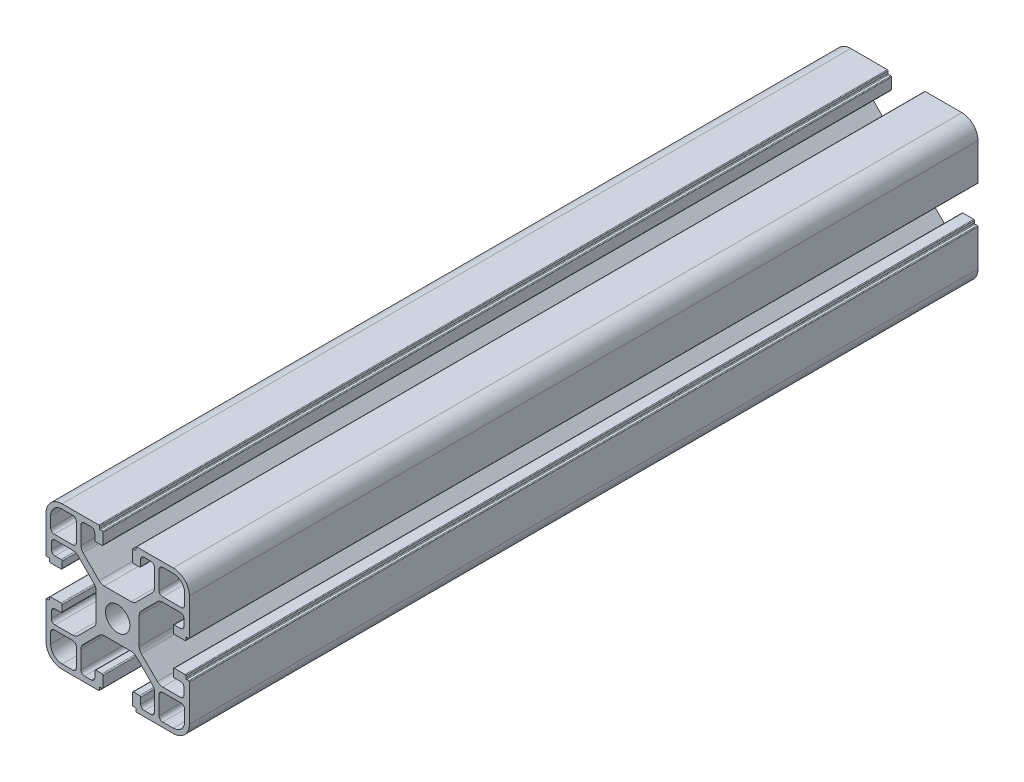
from build123d import *

# Parameters (mm, degrees)
SKETCH2_R           = 3.4
BOSS_EXTRUDE1_DEPTH = 220


with BuildPart() as part:
    # Sketch2 → Boss-Extrude1 (new body)
    with BuildSketch(Plane.XY):
        with BuildLine():
            Line((4.5, 0), (14.7, 0))
            ThreePointArc((14.7, 0), (14.841421356, 0.058578644), (14.9, 0.2))
            Line((14.9, 0.2), (14.9, 0.8))
            ThreePointArc((14.9, 0.8), (14.958578644, 0.941421356), (15.1, 1))
            Line((15.1, 1), (15.7, 1))
            ThreePointArc((15.7, 1), (15.841421356, 1.058578644), (15.9, 1.2))
            Line((15.9, 1.2), (15.9, 4.2))
            ThreePointArc((15.9, 4.2), (15.812132034, 4.412132034), (15.6, 4.5))
            Line((15.6, 4.5), (13.9, 4.5))
            ThreePointArc((13.9, 4.5), (13.687867966, 4.412132034), (13.6, 4.2))
            Line((13.6, 4.2), (13.6, 2.5))
            ThreePointArc((13.6, 2.5), (13.307106781, 1.792893219), (12.6, 1.5))
            Line((12.6, 1.5), (10.75, 1.5))
            ThreePointArc((10.75, 1.5), (10.042893219, 1.792893219), (9.75, 2.5))
            Line((9.75, 2.5), (9.75, 7.507359313))
            ThreePointArc((9.75, 7.507359313), (9.902240935, 8.272726178), (10.335786438, 8.921572875))
            Line((10.335786438, 8.921572875), (14.828427125, 13.414213562))
            ThreePointArc((14.828427125, 13.414213562), (15.477273822, 13.847759065), (16.242640687, 14))
            Line((16.242640687, 14), (23.757359313, 14))
            ThreePointArc((23.757359313, 14), (24.522726178, 13.847759065), (25.171572875, 13.414213562))
            Line((25.171572875, 13.414213562), (29.664213562, 8.921572875))
            ThreePointArc((29.664213562, 8.921572875), (30.097759065, 8.272726178), (30.25, 7.507359313))
            Line((30.25, 7.507359313), (30.25, 2.5))
            ThreePointArc((30.25, 2.5), (29.957106781, 1.792893219), (29.25, 1.5))
            Line((29.25, 1.5), (27.4, 1.5))
            ThreePointArc((27.4, 1.5), (26.692893219, 1.792893219), (26.4, 2.5))
            Line((26.4, 2.5), (26.4, 4.2))
            ThreePointArc((26.4, 4.2), (26.312132034, 4.412132034), (26.1, 4.5))
            Line((26.1, 4.5), (24.4, 4.5))
            ThreePointArc((24.4, 4.5), (24.187867966, 4.412132034), (24.1, 4.2))
            Line((24.1, 4.2), (24.1, 1.2))
            ThreePointArc((24.1, 1.2), (24.158578644, 1.058578644), (24.3, 1))
            Line((24.3, 1), (24.9, 1))
            ThreePointArc((24.9, 1), (25.041421356, 0.941421356), (25.1, 0.8))
            Line((25.1, 0.8), (25.1, 0.2))
            ThreePointArc((25.1, 0.2), (25.158578644, 0.058578644), (25.3, 0))
            Line((25.3, 0), (35.5, 0))
            ThreePointArc((35.5, 0), (38.681980515, 1.318019485), (40, 4.5))
            Line((40, 4.5), (40, 14.7))
            ThreePointArc((40, 14.7), (39.941421356, 14.841421356), (39.8, 14.9))
            Line((39.8, 14.9), (39.2, 14.9))
            ThreePointArc((39.2, 14.9), (39.058578644, 14.958578644), (39, 15.1))
            Line((39, 15.1), (39, 15.7))
            ThreePointArc((39, 15.7), (38.941421356, 15.841421356), (38.8, 15.9))
            Line((38.8, 15.9), (35.8, 15.9))
            ThreePointArc((35.8, 15.9), (35.587867966, 15.812132034), (35.5, 15.6))
            Line((35.5, 15.6), (35.5, 13.9))
            ThreePointArc((35.5, 13.9), (35.587867966, 13.687867966), (35.8, 13.6))
            Line((35.8, 13.6), (37.5, 13.6))
            ThreePointArc((37.5, 13.6), (38.207106781, 13.307106781), (38.5, 12.6))
            Line((38.5, 12.6), (38.5, 10.75))
            ThreePointArc((38.5, 10.75), (38.207106781, 10.042893219), (37.5, 9.75))
            Line((37.5, 9.75), (32.492640687, 9.75))
            ThreePointArc((32.492640687, 9.75), (31.727273822, 9.902240935), (31.078427125, 10.335786438))
            Line((31.078427125, 10.335786438), (26.585786438, 14.828427125))
            ThreePointArc((26.585786438, 14.828427125), (26.152240935, 15.477273822), (26, 16.242640687))
            Line((26, 16.242640687), (26, 23.757359313))
            ThreePointArc((26, 23.757359313), (26.152240935, 24.522726178), (26.585786438, 25.171572875))
            Line((26.585786438, 25.171572875), (31.078427125, 29.664213562))
            ThreePointArc((31.078427125, 29.664213562), (31.727273822, 30.097759065), (32.492640687, 30.25))
            Line((32.492640687, 30.25), (37.5, 30.25))
            ThreePointArc((37.5, 30.25), (38.207106781, 29.957106781), (38.5, 29.25))
            Line((38.5, 29.25), (38.5, 27.4))
            ThreePointArc((38.5, 27.4), (38.207106781, 26.692893219), (37.5, 26.4))
            Line((37.5, 26.4), (35.8, 26.4))
            ThreePointArc((35.8, 26.4), (35.587867966, 26.312132034), (35.5, 26.1))
            Line((35.5, 26.1), (35.5, 24.4))
            ThreePointArc((35.5, 24.4), (35.587867966, 24.187867966), (35.8, 24.1))
            Line((35.8, 24.1), (38.8, 24.1))
            ThreePointArc((38.8, 24.1), (38.941421356, 24.158578644), (39, 24.3))
            Line((39, 24.3), (39, 24.9))
            ThreePointArc((39, 24.9), (39.058578644, 25.041421356), (39.2, 25.1))
            Line((39.2, 25.1), (39.8, 25.1))
            ThreePointArc((39.8, 25.1), (39.941421356, 25.158578644), (40, 25.3))
            Line((40, 25.3), (40, 35.5))
            ThreePointArc((40, 35.5), (38.681980515, 38.681980515), (35.5, 40))
            Line((35.5, 40), (25.3, 40))
            ThreePointArc((25.3, 40), (25.158578644, 39.941421356), (25.1, 39.8))
            Line((25.1, 39.8), (25.1, 39.2))
            ThreePointArc((25.1, 39.2), (25.041421356, 39.058578644), (24.9, 39))
            Line((24.9, 39), (24.3, 39))
            ThreePointArc((24.3, 39), (24.158578644, 38.941421356), (24.1, 38.8))
            Line((24.1, 38.8), (24.1, 35.8))
            ThreePointArc((24.1, 35.8), (24.187867966, 35.587867966), (24.4, 35.5))
            Line((24.4, 35.5), (26.1, 35.5))
            ThreePointArc((26.1, 35.5), (26.312132034, 35.587867966), (26.4, 35.8))
            Line((26.4, 35.8), (26.4, 37.5))
            ThreePointArc((26.4, 37.5), (26.692893219, 38.207106781), (27.4, 38.5))
            Line((27.4, 38.5), (29.25, 38.5))
            ThreePointArc((29.25, 38.5), (29.957106781, 38.207106781), (30.25, 37.5))
            Line((30.25, 37.5), (30.25, 32.492640687))
            ThreePointArc((30.25, 32.492640687), (30.097759065, 31.727273822), (29.664213562, 31.078427125))
            Line((29.664213562, 31.078427125), (25.171572875, 26.585786438))
            ThreePointArc((25.171572875, 26.585786438), (24.522726178, 26.152240935), (23.757359313, 26))
            Line((23.757359313, 26), (16.242640687, 26))
            ThreePointArc((16.242640687, 26), (15.477273822, 26.152240935), (14.828427125, 26.585786438))
            Line((14.828427125, 26.585786438), (10.335786438, 31.078427125))
            ThreePointArc((10.335786438, 31.078427125), (9.902240935, 31.727273822), (9.75, 32.492640687))
            Line((9.75, 32.492640687), (9.75, 37.5))
            ThreePointArc((9.75, 37.5), (10.042893219, 38.207106781), (10.75, 38.5))
            Line((10.75, 38.5), (12.6, 38.5))
            ThreePointArc((12.6, 38.5), (13.307106781, 38.207106781), (13.6, 37.5))
            Line((13.6, 37.5), (13.6, 35.8))
            ThreePointArc((13.6, 35.8), (13.687867966, 35.587867966), (13.9, 35.5))
            Line((13.9, 35.5), (15.6, 35.5))
            ThreePointArc((15.6, 35.5), (15.812132034, 35.587867966), (15.9, 35.8))
            Line((15.9, 35.8), (15.9, 38.8))
            ThreePointArc((15.9, 38.8), (15.841421356, 38.941421356), (15.7, 39))
            Line((15.7, 39), (15.1, 39))
            ThreePointArc((15.1, 39), (14.958578644, 39.058578644), (14.9, 39.2))
            Line((14.9, 39.2), (14.9, 39.8))
            ThreePointArc((14.9, 39.8), (14.841421356, 39.941421356), (14.7, 40))
            Line((14.7, 40), (4.5, 40))
            ThreePointArc((4.5, 40), (1.318019485, 38.681980515), (0, 35.5))
            Line((0, 35.5), (0, 25.3))
            ThreePointArc((0, 25.3), (0.058578644, 25.158578644), (0.2, 25.1))
            Line((0.2, 25.1), (0.8, 25.1))
            ThreePointArc((0.8, 25.1), (0.941421356, 25.041421356), (1, 24.9))
            Line((1, 24.9), (1, 24.3))
            ThreePointArc((1, 24.3), (1.058578644, 24.158578644), (1.2, 24.1))
            Line((1.2, 24.1), (4.2, 24.1))
            ThreePointArc((4.2, 24.1), (4.412132034, 24.187867966), (4.5, 24.4))
            Line((4.5, 24.4), (4.5, 26.1))
            ThreePointArc((4.5, 26.1), (4.412132034, 26.312132034), (4.2, 26.4))
            Line((4.2, 26.4), (2.5, 26.4))
            ThreePointArc((2.5, 26.4), (1.792893219, 26.692893219), (1.5, 27.4))
            Line((1.5, 27.4), (1.5, 29.25))
            ThreePointArc((1.5, 29.25), (1.792893219, 29.957106781), (2.5, 30.25))
            Line((2.5, 30.25), (7.507359313, 30.25))
            ThreePointArc((7.507359313, 30.25), (8.272726178, 30.097759065), (8.921572875, 29.664213562))
            Line((8.921572875, 29.664213562), (13.414213562, 25.171572875))
            ThreePointArc((13.414213562, 25.171572875), (13.847759065, 24.522726178), (14, 23.757359313))
            Line((14, 23.757359313), (14, 16.242640687))
            ThreePointArc((14, 16.242640687), (13.847759065, 15.477273822), (13.414213562, 14.828427125))
            Line((13.414213562, 14.828427125), (8.921572875, 10.335786438))
            ThreePointArc((8.921572875, 10.335786438), (8.272726178, 9.902240935), (7.507359313, 9.75))
            Line((7.507359313, 9.75), (2.5, 9.75))
            ThreePointArc((2.5, 9.75), (1.792893219, 10.042893219), (1.5, 10.75))
            Line((1.5, 10.75), (1.5, 12.6))
            ThreePointArc((1.5, 12.6), (1.792893219, 13.307106781), (2.5, 13.6))
            Line((2.5, 13.6), (4.2, 13.6))
            ThreePointArc((4.2, 13.6), (4.412132034, 13.687867966), (4.5, 13.9))
            Line((4.5, 13.9), (4.5, 15.6))
            ThreePointArc((4.5, 15.6), (4.412132034, 15.812132034), (4.2, 15.9))
            Line((4.2, 15.9), (1.2, 15.9))
            ThreePointArc((1.2, 15.9), (1.058578644, 15.841421356), (1, 15.7))
            Line((1, 15.7), (1, 15.1))
            ThreePointArc((1, 15.1), (0.941421356, 14.958578644), (0.8, 14.9))
            Line((0.8, 14.9), (0.2, 14.9))
            ThreePointArc((0.2, 14.9), (0.058578644, 14.841421356), (0, 14.7))
            Line((0, 14.7), (0, 4.5))
            ThreePointArc((0, 4.5), (1.318019485, 1.318019485), (4.5, 0))
        make_face()
        with Locations((20, 20)):
            Circle(SKETCH2_R, mode=Mode.SUBTRACT)
        with BuildLine():
            Line((31.55, 37.7), (31.55, 32.55))
            ThreePointArc((31.55, 32.55), (31.842893219, 31.842893219), (32.55, 31.55))
            Line((32.55, 31.55), (37.7, 31.55))
            ThreePointArc((37.7, 31.55), (38.407106781, 31.842893219), (38.7, 32.55))
            Line((38.7, 32.55), (38.7, 35.5))
            ThreePointArc((38.7, 35.5), (37.7627417, 37.7627417), (35.5, 38.7))
            Line((35.5, 38.7), (32.55, 38.7))
            ThreePointArc((32.55, 38.7), (31.842893219, 38.407106781), (31.55, 37.7))
        make_face(mode=Mode.SUBTRACT)
        with BuildLine():
            Line((1.3, 35.5), (1.3, 32.55))
            ThreePointArc((1.3, 32.55), (1.592893219, 31.842893219), (2.3, 31.55))
            Line((2.3, 31.55), (7.45, 31.55))
            ThreePointArc((7.45, 31.55), (8.157106781, 31.842893219), (8.45, 32.55))
            Line((8.45, 32.55), (8.45, 37.7))
            ThreePointArc((8.45, 37.7), (8.157106781, 38.407106781), (7.45, 38.7))
            Line((7.45, 38.7), (4.5, 38.7))
            ThreePointArc((4.5, 38.7), (2.2372583, 37.7627417), (1.3, 35.5))
        make_face(mode=Mode.SUBTRACT)
        with BuildLine():
            Line((1.3, 7.45), (1.3, 4.5))
            ThreePointArc((1.3, 4.5), (2.2372583, 2.2372583), (4.5, 1.3))
            Line((4.5, 1.3), (7.45, 1.3))
            ThreePointArc((7.45, 1.3), (8.157106781, 1.592893219), (8.45, 2.3))
            Line((8.45, 2.3), (8.45, 7.45))
            ThreePointArc((8.45, 7.45), (8.157106781, 8.157106781), (7.45, 8.45))
            Line((7.45, 8.45), (2.3, 8.45))
            ThreePointArc((2.3, 8.45), (1.592893219, 8.157106781), (1.3, 7.45))
        make_face(mode=Mode.SUBTRACT)
        with BuildLine():
            Line((31.55, 7.45), (31.55, 2.3))
            ThreePointArc((31.55, 2.3), (31.842893219, 1.592893219), (32.55, 1.3))
            Line((32.55, 1.3), (35.5, 1.3))
            ThreePointArc((35.5, 1.3), (37.7627417, 2.2372583), (38.7, 4.5))
            Line((38.7, 4.5), (38.7, 7.45))
            ThreePointArc((38.7, 7.45), (38.407106781, 8.157106781), (37.7, 8.45))
            Line((37.7, 8.45), (32.55, 8.45))
            ThreePointArc((32.55, 8.45), (31.842893219, 8.157106781), (31.55, 7.45))
        make_face(mode=Mode.SUBTRACT)
    extrude(amount=BOSS_EXTRUDE1_DEPTH)


solid = part.part
